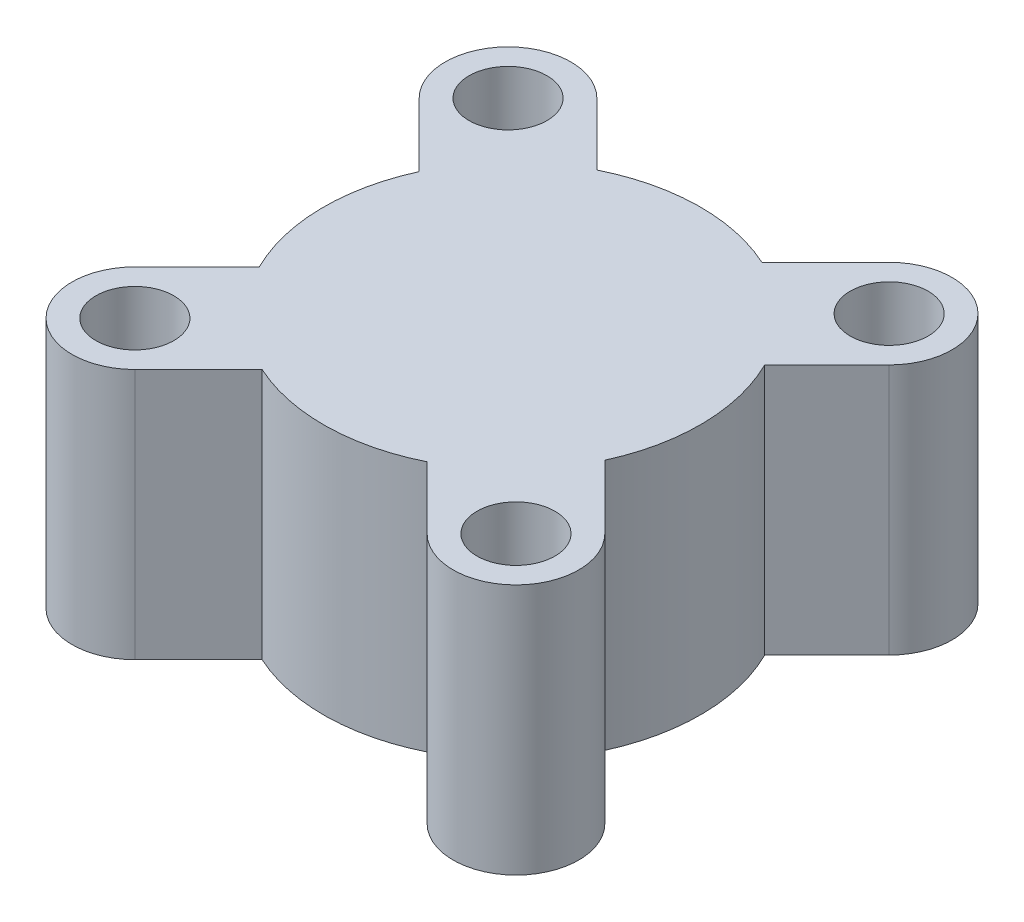
from build123d import *

# Parameters (mm, degrees)
SKETCH1_R           = 7.5
BOSS_EXTRUDE1_DEPTH = 10
SKETCH3_R           = 1.55
BOSS_EXTRUDE2_DEPTH = 10
SKETCH4_R           = 6.05
CUT_EXTRUDE2_DEPTH  = 8


with BuildPart() as part:
    # Sketch1 → Boss-Extrude1 (new body)
    with BuildSketch(Plane(origin=(0, 0, 0), x_dir=(1, 0, 0), z_dir=(0, 1, 0))):
        with Locations(Location((0, 0, 0), (0, 0, 270))):
            Circle(SKETCH1_R)
    extrude(amount=BOSS_EXTRUDE1_DEPTH)

    # Sketch3 → Boss-Extrude2 (add)
    # profile 1 of 4: a face of its own
    with BuildSketch(Plane.XZ):
        with BuildLine():
            Line((-5.657484018, 9.350809391), (-3.123198857, 6.818770336))
            ThreePointArc((-3.123198857, 6.818770336), (-5.217761179, 5.387482554), (-6.715339638, 3.339792441))
            Line((-6.715339638, 3.339792441), (-9.191450131, 5.813708387))
            ThreePointArc((-9.191450131, 5.813708387), (-9.193017577, 9.349241945), (-5.657484018, 9.350809391))
        make_face()
        with Locations(Location((-7.424467075, 7.582258889, 0), (0, 0, 270))):
            Circle(SKETCH3_R, mode=Mode.SUBTRACT)
    # profile 2 of 4: a face of its own
    with BuildSketch(Plane.XZ):
        with BuildLine():
            Line((5.813708387, 9.191450131), (3.339792441, 6.715339638))
            ThreePointArc((3.339792441, 6.715339638), (5.387482554, 5.217761179), (6.818770336, 3.123198857))
            Line((6.818770336, 3.123198857), (9.350809391, 5.657484018))
            ThreePointArc((9.350809391, 5.657484018), (9.349241945, 9.193017577), (5.813708387, 9.191450131))
        make_face()
        with Locations(Location((7.582258889, 7.424467075, 0), (0, 0, 270))):
            Circle(SKETCH3_R, mode=Mode.SUBTRACT)
    # profile 3 of 4: a face of its own
    with BuildSketch(Plane.XZ):
        with BuildLine():
            Line((9.191450131, -5.813708387), (6.715339638, -3.339792441))
            ThreePointArc((6.715339638, -3.339792441), (5.217761179, -5.387482554), (3.123198857, -6.818770336))
            Line((3.123198857, -6.818770336), (5.657484018, -9.350809391))
            ThreePointArc((5.657484018, -9.350809391), (9.193017577, -9.349241945), (9.191450131, -5.813708387))
        make_face()
        with Locations(Location((7.424467075, -7.582258889, 0), (0, 0, 270))):
            Circle(SKETCH3_R, mode=Mode.SUBTRACT)
    # profile 4 of 4: a face of its own
    with BuildSketch(Plane.XZ):
        with BuildLine():
            Line((-5.813708387, -9.191450131), (-3.339792441, -6.715339638))
            ThreePointArc((-3.339792441, -6.715339638), (-5.387482554, -5.217761179), (-6.818770336, -3.123198857))
            Line((-6.818770336, -3.123198857), (-9.350809391, -5.657484018))
            ThreePointArc((-9.350809391, -5.657484018), (-9.349241945, -9.193017577), (-5.813708387, -9.191450131))
        make_face()
        with Locations(Location((-7.582258889, -7.424467075, 0), (0, 0, 270))):
            Circle(SKETCH3_R, mode=Mode.SUBTRACT)
    extrude(amount=-BOSS_EXTRUDE2_DEPTH)

    # Sketch4 → Cut-Extrude2 (cut)
    with BuildSketch(Plane.XZ):
        with Locations(Location((0, 0, 0), (0, 0, 270))):
            Circle(SKETCH4_R)
    extrude(amount=-CUT_EXTRUDE2_DEPTH, mode=Mode.SUBTRACT)


solid = part.part
